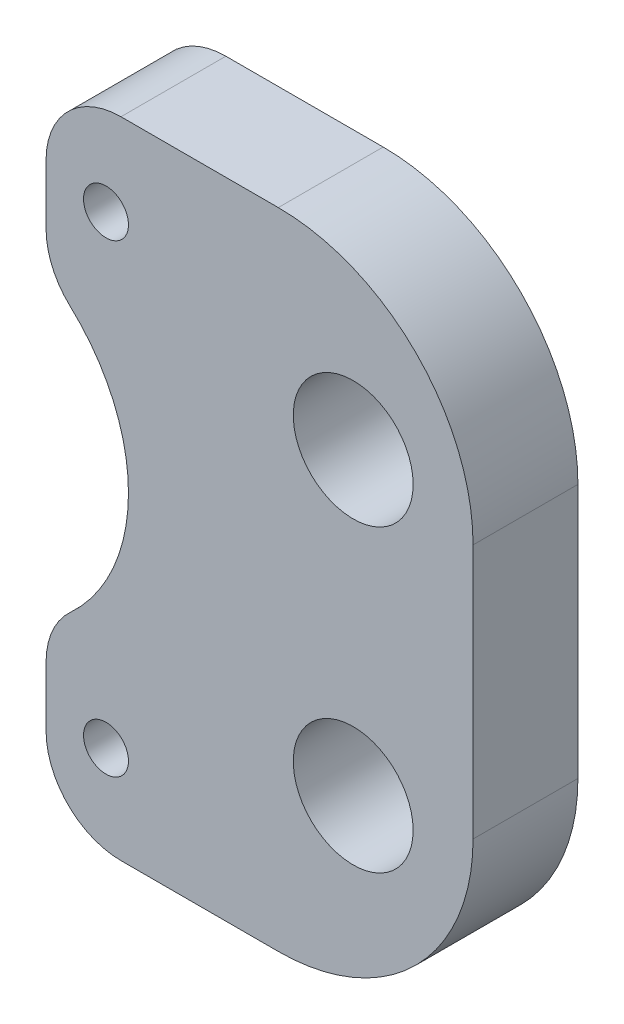
from build123d import *

# Parameters (mm, degrees)
CROQUIS1_R              = 4
CROQUIS1_R_2            = 1.5
SALIENTE_EXTRUIR1_DEPTH = 7


with BuildPart() as part:
    # Croquis1 → Saliente-Extruir1 (new body)
    with BuildSketch(Plane.XY):
        with BuildLine():
            Line((5, 0), (15.5, 0))
            ThreePointArc((15.5, 0), (24.692388155, 3.807611845), (28.5, 13))
            Line((28.5, 13), (28.5, 30))
            ThreePointArc((28.5, 30), (24.692388155, 39.192388155), (15.5, 43))
            Line((15.5, 43), (5, 43))
            ThreePointArc((5, 43), (1.464466094, 41.535533906), (0, 38))
            Line((0, 38), (0, 34.019984026))
            ThreePointArc((0, 34.019984026), (0.422240466, 32.008984859), (1.617647059, 30.337635783))
            ThreePointArc((1.617647059, 30.337635783), (5.5, 21.5), (1.617647059, 12.662364217))
            ThreePointArc((1.617647059, 12.662364217), (0.422240466, 10.991015141), (0, 8.980015974))
            Line((0, 8.980015974), (0, 5))
            ThreePointArc((0, 5), (1.464466094, 1.464466094), (5, 0))
        make_face()
        with Locations((20.5, 31.5)):
            Circle(CROQUIS1_R, mode=Mode.SUBTRACT)
        with Locations((20.5, 11.5)):
            Circle(CROQUIS1_R, mode=Mode.SUBTRACT)
        with Locations((4, 37)):
            Circle(CROQUIS1_R_2, mode=Mode.SUBTRACT)
        with Locations((4, 6)):
            Circle(CROQUIS1_R_2, mode=Mode.SUBTRACT)
    extrude(amount=SALIENTE_EXTRUIR1_DEPTH)


solid = part.part
